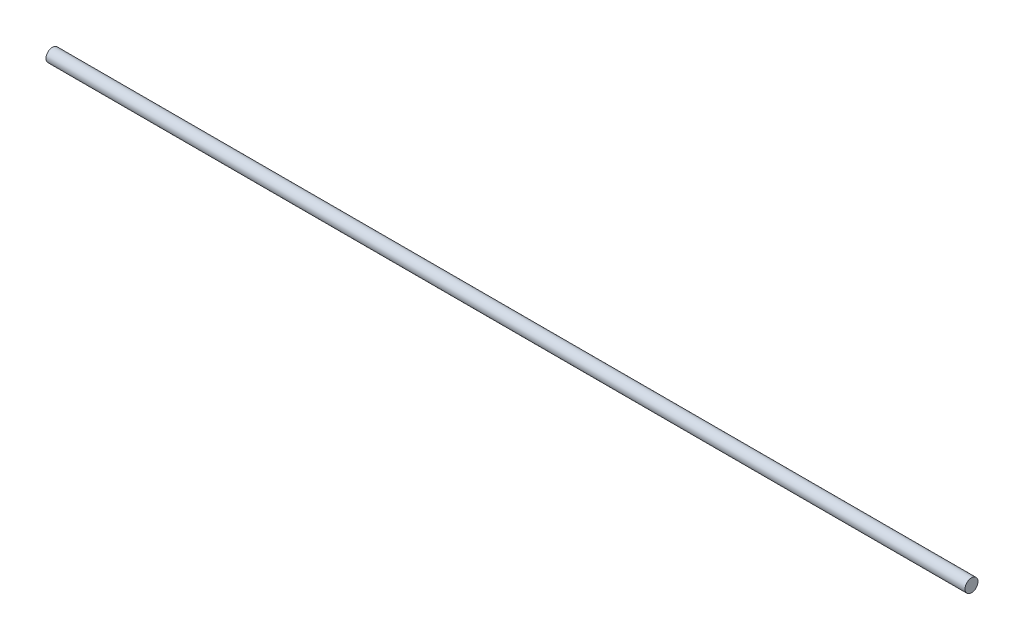
from build123d import *

# Parameters (mm, degrees)
SKETCH1_R           = 6.35
BOSS_EXTRUDE1_DEPTH = 897.937263729


with BuildPart() as part:
    # Sketch1 → Boss-Extrude1 (new body)
    with BuildSketch(Plane.YZ):
        with Locations(Location((0, 0, 0), (0, 0, 270))):
            Circle(SKETCH1_R)
    extrude(amount=BOSS_EXTRUDE1_DEPTH)


solid = part.part
